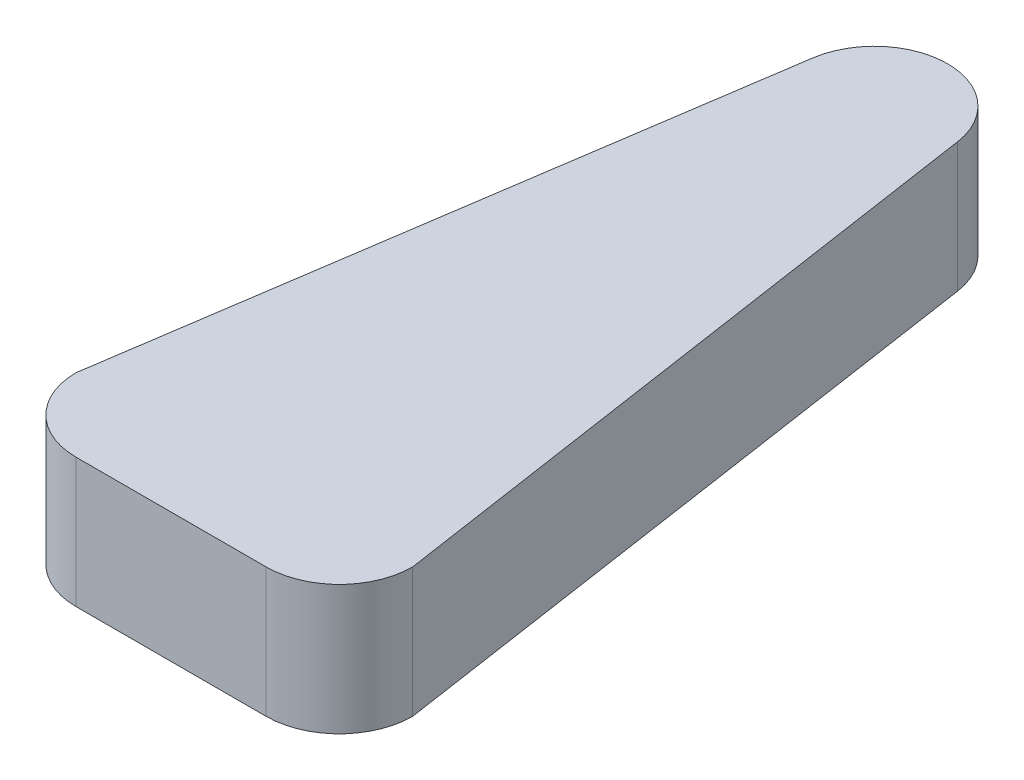
from build123d import *

# Parameters (mm, degrees)
BOSS_EXTRUDE1_DEPTH = 6.35
CUT_EXTRUDE1_DEPTH  = 2.413


with BuildPart() as part:
    # Sketch1 → Boss-Extrude1 (new body)
    with BuildSketch(Plane(origin=(0, 0, 0), x_dir=(1, 0, 0), z_dir=(0, 1, 0))):
        with BuildLine():
            Line((3.556, 35.035972622), (8.255, 3.595496557))
            ThreePointArc((8.255, 3.595496557), (7.20190344, 1.05309656), (4.659503443, 0))
            Line((4.659503443, 0), (-4.659503443, 0))
            ThreePointArc((-4.659503443, 0), (-7.20190344, 1.05309656), (-8.255, 3.595496557))
            Line((-8.255, 3.595496557), (-3.556, 35.035972622))
            ThreePointArc((-3.556, 35.035972622), (0, 38.1), (3.556, 35.035972622))
        make_face()
    extrude(amount=BOSS_EXTRUDE1_DEPTH)

    # Sketch2 → Cut-Extrude1 (cut)
    with BuildSketch(Plane.XZ):
        with BuildLine():
            Line((-6.983475796, -3.511313771), (-2.299950959, -34.84824727))
            ThreePointArc((-2.299950959, -34.84824727), (0, -36.83), (2.299950959, -34.84824727))
            Line((2.299950959, -34.84824727), (6.983475796, -3.511313771))
            ThreePointArc((6.983475796, -3.511313771), (6.273840375, -1.92162365), (4.659503443, -1.27))
            Line((4.659503443, -1.27), (-4.659503443, -1.27))
            ThreePointArc((-4.659503443, -1.27), (-6.273840375, -1.92162365), (-6.983475796, -3.511313771))
        make_face()
    extrude(amount=-CUT_EXTRUDE1_DEPTH, mode=Mode.SUBTRACT)


solid = part.part
